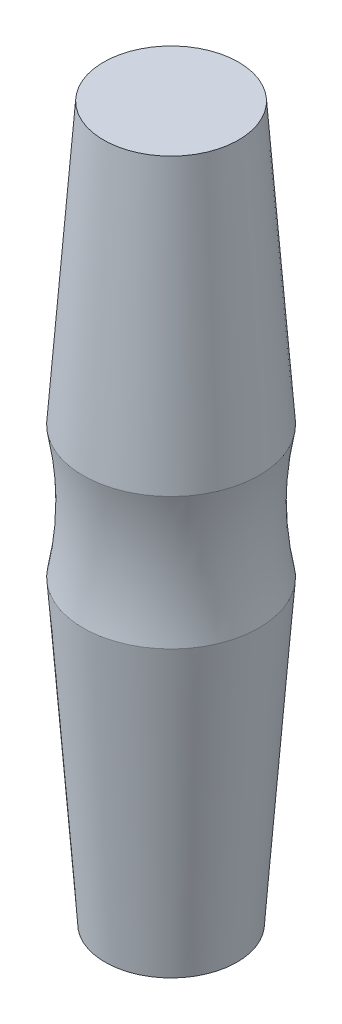
from build123d import *


with BuildPart() as part:
    # Sketch1 → Revolve1 (revolve)
    with BuildSketch(Plane.XY, mode=Mode.PRIVATE) as revolve1_sk:
        with BuildLine():
            Line((0, 31.47), (6.134749176, 31.47))
            Line((6.134749176, 31.47), (8, 6))
            ThreePointArc((8, 6), (7.405882918, 0), (8, -6))
            Line((8, -6), (6, -33.31))
            Line((6, -33.31), (0, -33.31))
            Line((0, -33.31), (0, 31.47))
        make_face()
    revolve(revolve1_sk.sketch.rotate(Axis((0, -44.013751718, 0), (0, 1, 0)), 90), axis=Axis((0, -44.013751718, 0), (0, 1, 0)))


solid = part.part
